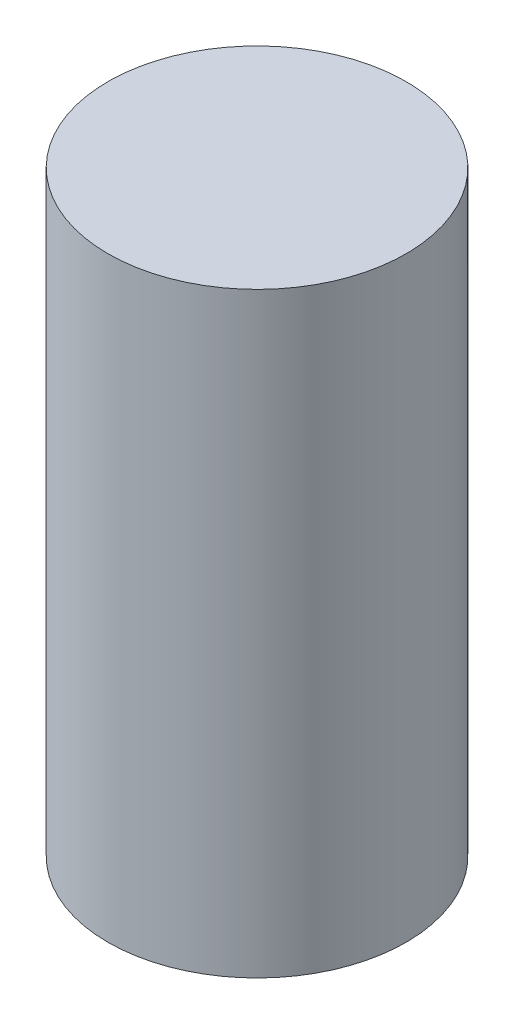
from build123d import *

# Parameters (mm, degrees)
SKETCH1_R           = 1.25
BOSS_EXTRUDE1_DEPTH = 5


with BuildPart() as part:
    # Sketch1 → Boss-Extrude1 (new body)
    with BuildSketch(Plane(origin=(0, 0, 0), x_dir=(1, 0, 0), z_dir=(0, 1, 0))):
        with Locations(Location((0, 0, 0), (0, 0, 270))):
            Circle(SKETCH1_R)
    extrude(amount=BOSS_EXTRUDE1_DEPTH)


solid = part.part
